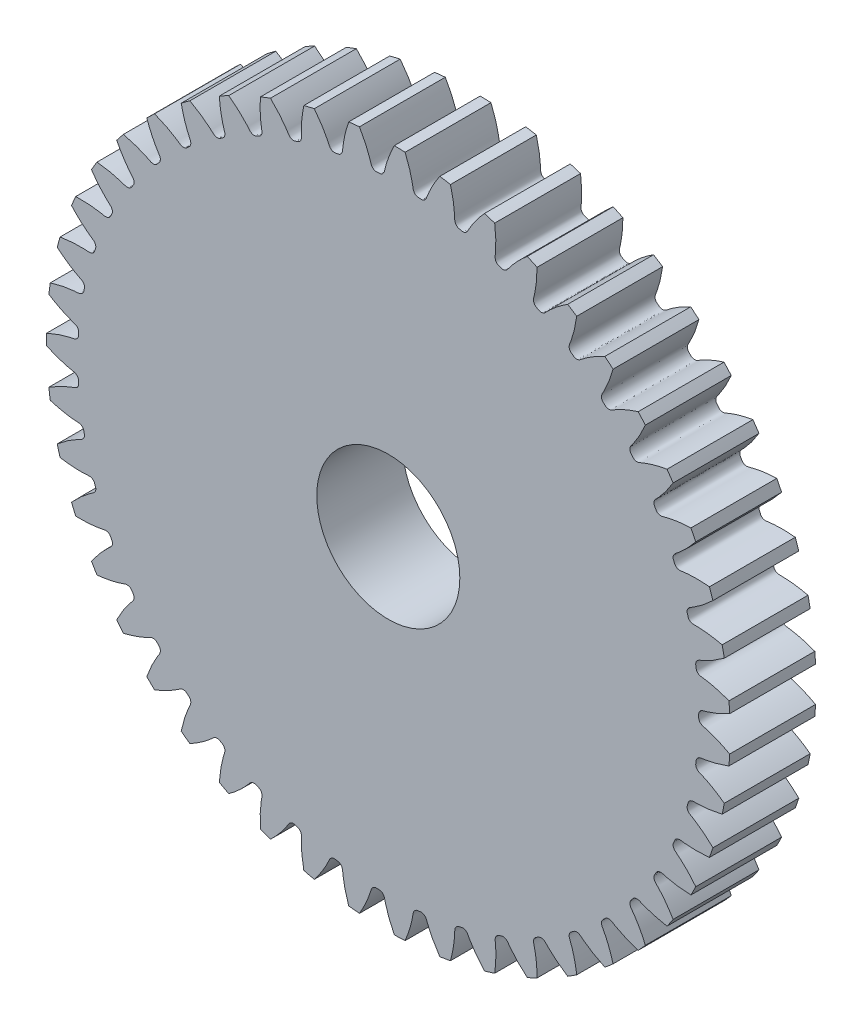
from build123d import *

# Parameters (mm, degrees)
SKETCHREVOLVESPURGEAR_W       = 1.2
SKETCHREVOLVESPURGEAR_H       = 4.777499928
TOOTHEXTRUDECUTSPURGEAR_DEPTH = 9.525
PATTERNSPURGEAR_COUNT         = 47
SKETCH6_R                     = 1
CUT_EXTRUDE2_DEPTH            = 10


with BuildPart() as part:
    # SketchRevolveSpurGear → SpurGear (revolve)
    with BuildSketch(Plane(origin=(0, 0, 0), x_dir=(0, 0, -1), z_dir=(1, 0, 0))):
        with Locations((0, 2.388749964)):
            Rectangle(SKETCHREVOLVESPURGEAR_W, SKETCHREVOLVESPURGEAR_H)
    revolve(axis=Axis((0, 0, 0), (0, 0, -1)))

    # SketchToothSpurGear → ToothExtrudeCutSpurGear (cut, symmetric)
    with BuildSketch(Plane.XY):
        with BuildLine():
            ThreePointArc((4.780758976, 0.249209718), (4.787249928, 0), (4.780758976, -0.249209718))
            add(Edge.make_bspline(
                [(4.780758976, -0.249209718), (4.763440041, -0.239652744), (4.737664718, -0.225901722), (4.703448745, -0.208615675), (4.678842289, -0.196632761), (4.654897296, -0.185402085), (4.631630326, -0.174901656), (4.609057438, -0.165109158), (4.587194184, -0.156001957), (4.566055589, -0.147557148), (4.545656208, -0.139751431), (4.526009891, -0.132561592), (4.507130584, -0.125962863), (4.489029524, -0.119934699), (4.471724947, -0.114440733), (4.455208467, -0.109498259), (4.427193871, -0.10133474), (4.40053925, -0.096137305), (4.37809338, -0.084991725), (4.368641221, -0.078993194), (4.358708967, -0.070596573), (4.348697028, -0.058362058), (4.340951057, -0.041742505), (4.337928422, -0.021385816), (4.339185287, 0), (4.337928422, 0.021385816), (4.340951057, 0.041742505), (4.348697028, 0.058362058), (4.358708967, 0.070596573), (4.368641221, 0.078993194), (4.37809338, 0.084991725), (4.40053925, 0.096137305), (4.427193871, 0.10133474), (4.455208467, 0.109498259), (4.471724947, 0.114440733), (4.489029524, 0.119934699), (4.507130584, 0.125962863), (4.526009891, 0.132561592), (4.545656208, 0.139751431), (4.566055589, 0.147557148), (4.587194184, 0.156001957), (4.609057438, 0.165109158), (4.631630326, 0.174901656), (4.654897296, 0.185402085), (4.678842289, 0.196632761), (4.703448745, 0.208615675), (4.737664718, 0.225901722), (4.763440041, 0.239652744), (4.780758976, 0.249209718)],
                knots=[0, 0, 0, 0, 0.055397769, 0.081806722, 0.10735572, 0.132044763, 0.155873852, 0.178842986, 0.200952165, 0.22220139, 0.24259066, 0.262119975, 0.280789336, 0.298598742, 0.315548193, 0.33163769, 0.346867232, 0.39734741, 0.406727594, 0.416894986, 0.428636038, 0.4430043, 0.460850353, 0.479253038, 0.5, 0.520746962, 0.539149647, 0.5569957, 0.571363962, 0.583105014, 0.593272406, 0.60265259, 0.653132768, 0.66836231, 0.684451807, 0.701401258, 0.719210664, 0.737880025, 0.75740934, 0.77779861, 0.799047835, 0.821157014, 0.844126148, 0.867955237, 0.89264428, 0.918193278, 0.944602231, 1, 1, 1, 1], degree=3))
        make_face()
    toothextrudecutspurgear = extrude(amount=TOOTHEXTRUDECUTSPURGEAR_DEPTH, both=True, mode=Mode.SUBTRACT)

    # PatternSpurGear: ToothExtrudeCutSpurGear ×47 about axis
    patternspurgear_axis = Axis((0, 0, 55), (0, 0, -1))
    for i in range(1, PATTERNSPURGEAR_COUNT):
        add(toothextrudecutspurgear.rotate(patternspurgear_axis, i * 360 / PATTERNSPURGEAR_COUNT), mode=Mode.SUBTRACT)

    # Sketch6 → Cut-Extrude2 (cut)
    with BuildSketch(Plane.XY.offset(0.6)):
        Circle(SKETCH6_R)
    extrude(amount=-CUT_EXTRUDE2_DEPTH, mode=Mode.SUBTRACT)


solid = part.part
